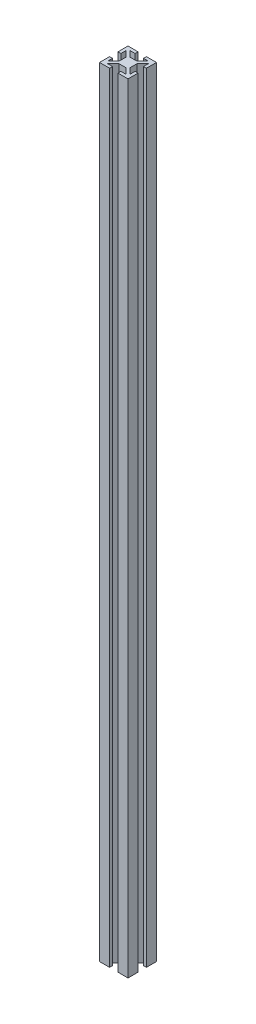
from build123d import *

# Parameters (mm, degrees)
BOSS_EXTRUDE1_DEPTH = 762


with BuildPart() as part:
    # Sketch1 → Boss-Extrude1 (new body)
    with BuildSketch(Plane(origin=(0, 0, 0), x_dir=(1, 0, 0), z_dir=(0, 1, 0))):
        Polygon((-13.925, -13.925), (-4.1, -13.925), (-4.1, -11.040001795), (-9, -11.040001795), (-3.444998205, -5.485), (3.444998205, -5.485), (9, -11.040001795), (4.1, -11.040001795), (4.1, -13.925), (13.925, -13.925), (13.925, -4.1), (11.040001795, -4.1), (11.040001795, -9), (5.485, -3.444998205), (5.485, 3.444998205), (11.040001795, 9), (11.040001795, 4.1), (13.925, 4.1), (13.925, 13.925), (4.1, 13.925), (4.1, 11.040001795), (9, 11.040001795), (3.444998205, 5.485), (-3.444998205, 5.485), (-9, 11.040001795), (-4.1, 11.040001795), (-4.1, 13.925), (-13.925, 13.925), (-13.925, 4.1), (-11.040001795, 4.1), (-11.040001795, 9), (-5.485, 3.444998205), (-5.485, -3.444998205), (-11.040001795, -9), (-11.040001795, -4.1), (-13.925, -4.1), align=None)
    extrude(amount=BOSS_EXTRUDE1_DEPTH)


solid = part.part
